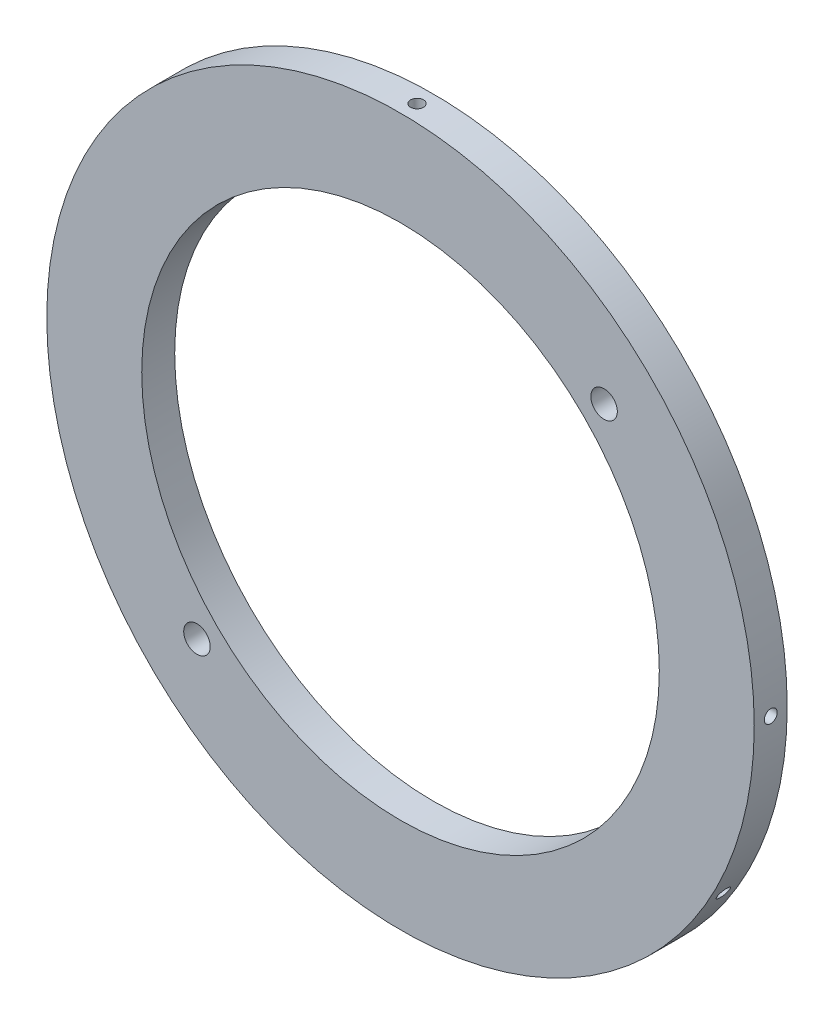
from build123d import *

# Parameters (mm, degrees)
SKETCH1_R         = 68.1355
SKETCH1_R_2       = 49.8475
EXTRUDE1_DEPTH    = 6.35
CIRPATTERN1_COUNT = 4
CIRPATTERN3_COUNT = 3
CIRPATTERN2_COUNT = 2


with BuildPart() as part:
    # Sketch1 → Extrude1 (new body)
    with BuildSketch(Plane.XY):
        Circle(SKETCH1_R)
        Circle(SKETCH1_R_2, mode=Mode.SUBTRACT)
    extrude(amount=EXTRUDE1_DEPTH)

    # Sketch4 → M3x0.5 Tapped Hole1 (revolve, cut)
    with BuildSketch(Plane(origin=(0, 68.1355, 3.175), x_dir=(0, 0, 1), z_dir=(1, 0, 0))):
        Polygon((0, 0), (0, 9.387075774), (1.25, 8.636), (1.25, 0), align=None)
    m3x0_5_tapped_hole1 = revolve(axis=Axis((0, 74.4855, 3.175), (0, -1, 0)), mode=Mode.SUBTRACT)

    # CirPattern1: M3x0.5 Tapped Hole1 ×4 about axis
    cirpattern1_axis = Axis((0, 0, 6.35), (0, 0, -1))
    for i in range(1, CIRPATTERN1_COUNT):
        add(m3x0_5_tapped_hole1.rotate(cirpattern1_axis, i * 360 / CIRPATTERN1_COUNT), mode=Mode.SUBTRACT)

    # CirPattern3: M3x0.5 Tapped Hole1 ×3 about axis
    cirpattern3_axis = Axis((0, 0, 6.35), (0, 0, -1))
    for i in range(1, CIRPATTERN3_COUNT):
        add(m3x0_5_tapped_hole1.rotate(cirpattern3_axis, i * 360 / CIRPATTERN3_COUNT), mode=Mode.SUBTRACT)

    # Sketch18 → 1/4-20 Tapped Hole1 (revolve, cut)
    with BuildSketch(Plane(origin=(39.207798225, 39.207798225, 6.35), x_dir=(0, -1, 0), z_dir=(1, 0, 0))):
        Polygon((0, 0), (0, 20.583816902), (2.5527, 19.05), (2.5527, 0), align=None)
    f_1_4_20_tapped_hole1 = revolve(axis=Axis((39.207798225, 39.207798225, 12.7), (0, 0, -1)), mode=Mode.SUBTRACT)

    # CirPattern2: 1/4-20 Tapped Hole1 ×2 about axis
    cirpattern2_axis = Axis((0, 0, 0), (0, 0, 1))
    for i in range(1, CIRPATTERN2_COUNT):
        add(f_1_4_20_tapped_hole1.rotate(cirpattern2_axis, i * 360 / CIRPATTERN2_COUNT), mode=Mode.SUBTRACT)


solid = part.part
